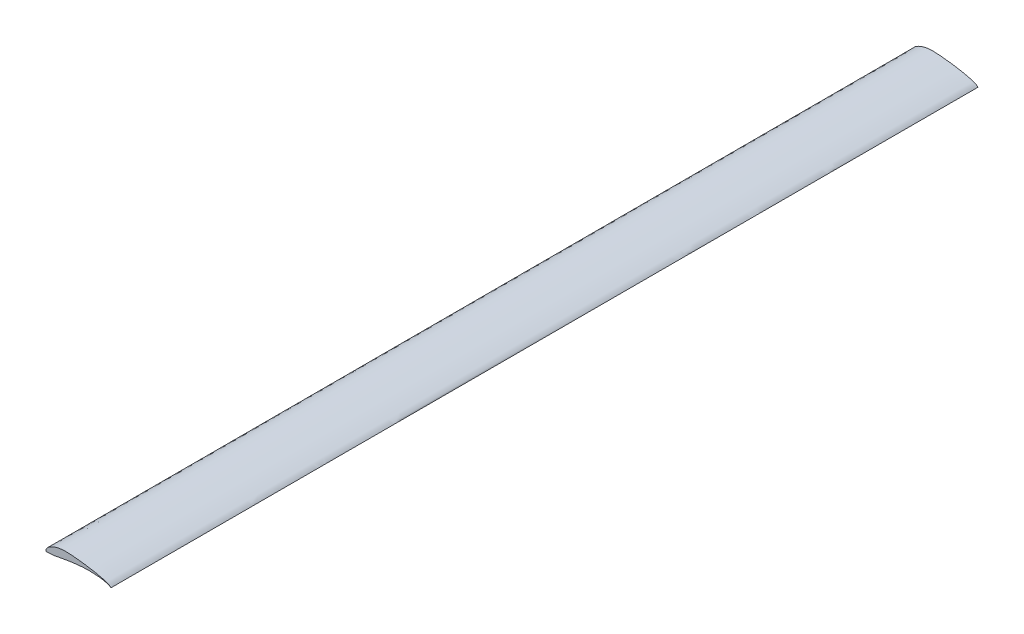
from build123d import *

# Parameters (mm, degrees)
BOSS_EXTRUDE2_DEPTH      = 2000
BOSS_EXTRUDE2_DEPTH_BACK = 2000


with BuildPart() as part:
    # Sketch2 → Boss-Extrude2 (new, two sides: drawn at the far end of the back side and taken through both)
    with BuildSketch(Plane.XY.offset(-BOSS_EXTRUDE2_DEPTH_BACK)):
        with BuildLine():
            add(Edge.make_bspline(
                [(300, 0), (300.001795984, 0.007637159), (299.015585752, 0.742430957), (298.181525628, 1.560788429), (296.329575234, 3.27008917), (294.144706765, 5.08845831), (291.155994363, 6.921576722), (287.439507775, 8.698075698), (282.952833808, 10.552067555), (277.70281147, 12.457737175), (271.713933683, 14.401622415), (265.0172908, 16.36684572), (257.650382156, 18.344183274), (249.653884637, 20.315479342), (241.073644249, 22.266463807), (231.96080134, 24.184950832), (222.371003157, 26.061077929), (212.360297763, 27.871758245), (201.991724454, 29.614404837), (191.325038142, 31.266577781), (180.429220564, 32.831503266), (169.374100906, 34.29678004), (158.239751449, 35.657719296), (147.115182873, 36.923957223), (136.092490036, 38.063543367), (125.26147313, 39.055149078), (114.698308674, 39.842961371), (104.463337343, 40.384875117), (94.613499628, 40.618898721), (85.199254847, 40.593988438), (76.238164208, 40.133039488), (67.72675643, 39.198947205), (59.630383475, 37.878126865), (51.947091278, 36.167015776), (44.6847733, 34.160499335), (37.874157306, 31.894116023), (31.544208217, 29.420865293), (25.73426108, 26.753997916), (20.462948117, 23.94765897), (15.758947004, 21.03376195), (11.651757018, 18.05179269), (8.143072782, 15.064957634), (5.283776381, 12.040653236), (3.087472036, 9.005070035), (1.465117332, 6.051851846), (0.425359658, 3.247911094), (-0.070084924, 0.659874628), (0.025549289, -1.528990788), (0.589081225, -3.53653308), (2.683819667, -4.53309178), (5.500223008, -4.672905827), (9.353052278, -4.808414152), (14.198257, -4.59947875), (19.981076791, -4.215519154), (26.637154902, -3.600499142), (34.09838121, -2.768350622), (42.328372813, -1.701217188), (51.323107837, -0.209739429), (61.126380875, 1.660549504), (71.787201693, 3.696020688), (83.253461068, 5.84518644), (95.453138833, 8.01884175), (108.296640118, 10.135411883), (121.684324146, 12.124219024), (135.500816475, 13.912306573), (149.621869257, 15.447609735), (163.914090851, 16.661203668), (178.234055291, 17.521492124), (192.432155707, 17.994440339), (206.354367624, 18.054177088), (219.845366965, 17.696643536), (232.750673794, 16.930209613), (244.915103624, 15.764764382), (256.193831635, 14.245043325), (266.440012399, 12.415143021), (275.533513985, 10.336349098), (283.306747334, 8.11194699), (289.668337182, 5.737873027), (294.207167782, 3.565291409), (297.553526416, 1.55644947), (298.839053505, 0.779060778), (299.998167504, -0.007792421), (300, 0)],
                knots=[0, 0, 0, 0, 0.000979678, 0.003648862, 0.007483499, 0.012095277, 0.017525591, 0.02405178, 0.031783051, 0.040677828, 0.050710301, 0.061833229, 0.07398925, 0.087118173, 0.101145049, 0.115990637, 0.131570422, 0.147788379, 0.164550917, 0.181757895, 0.199311955, 0.217095072, 0.234990228, 0.252856883, 0.270540594, 0.287886779, 0.304773438, 0.321101419, 0.336806063, 0.351800033, 0.366031063, 0.379615675, 0.392652963, 0.405170359, 0.417171919, 0.428603517, 0.439418959, 0.449596586, 0.459102079, 0.467907878, 0.475988301, 0.483308969, 0.489874508, 0.49580325, 0.501149412, 0.505903073, 0.510046769, 0.513579311, 0.516446927, 0.519350053, 0.523823355, 0.529973794, 0.537715654, 0.546967844, 0.557637367, 0.569620481, 0.582804124, 0.597246961, 0.613135037, 0.6304436, 0.649056124, 0.668822257, 0.689594964, 0.711189651, 0.733426689, 0.756094118, 0.778988554, 0.801889683, 0.824566598, 0.846792285, 0.868338291, 0.888978163, 0.908492011, 0.926658768, 0.943286193, 0.95816921, 0.971135822, 0.981955623, 0.990251791, 0.995852565, 0.999000406, 1, 1, 1, 1], degree=3))
        make_face()
    extrude(amount=BOSS_EXTRUDE2_DEPTH + BOSS_EXTRUDE2_DEPTH_BACK)


solid = part.part
